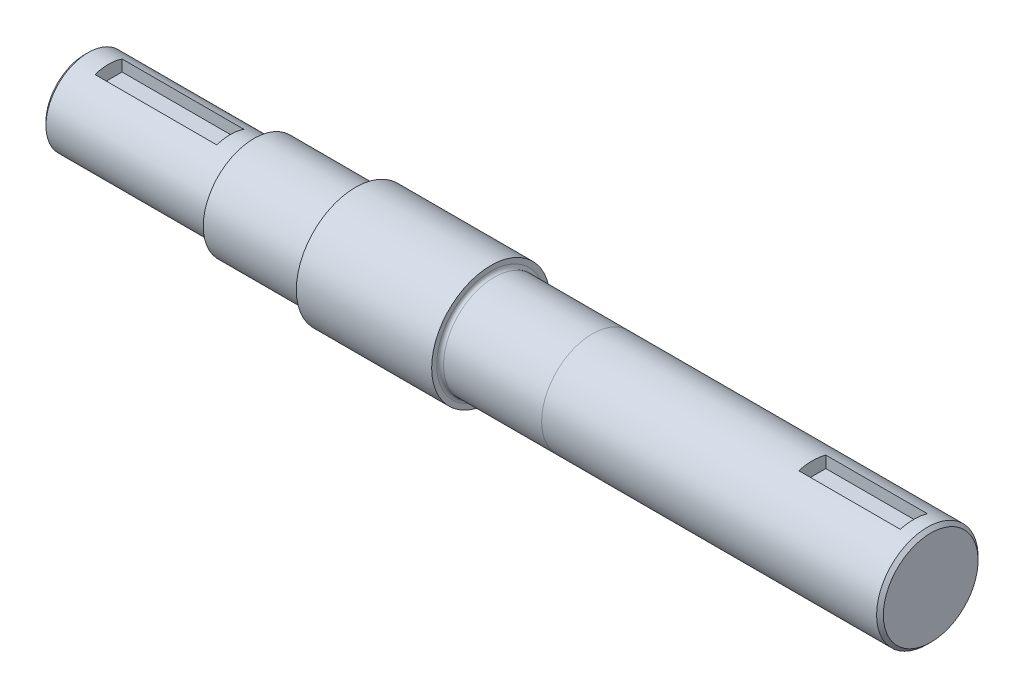
from build123d import *

# Parameters (mm, degrees)
SKETCH2_W          = 36
SKETCH2_H          = 8
CUT_EXTRUDE2_DEPTH = 252.956841542
SKETCH3_W          = 30
SKETCH3_H          = 8
CUT_EXTRUDE3_DEPTH = 253.227080227
FILLET1_R          = 1
CHAMFER1_SIZE      = 1


with BuildPart() as part:
    # Sketch1 → Revolve1 (revolve)
    with BuildSketch(Plane.XY, mode=Mode.PRIVATE) as revolve1_sk:
        Polygon((0, 0), (0, 12.5), (50, 12.5), (50, 15), (80, 15), (80, 17.5), (120, 17.5), (120, 15), (250, 15), (250, 0), align=None)
    revolve(revolve1_sk.sketch.rotate(Axis((0, 0, 0), (1, 0, 0)), 90), axis=Axis((0, 0, 0), (1, 0, 0)))

    # Sketch2 → Cut-Extrude2 (cut, through all)
    with BuildSketch(Plane(origin=(0, 8.5, 0), x_dir=(1, 0, 0), z_dir=(0, 1, 0))):
        with Locations((25, 0)):
            Rectangle(SKETCH2_W, SKETCH2_H)
    extrude(amount=CUT_EXTRUDE2_DEPTH, mode=Mode.SUBTRACT)

    # Sketch3 → Cut-Extrude3 (cut, through all)
    with BuildSketch(Plane(origin=(0, 11, 0), x_dir=(1, 0, 0), z_dir=(0, 1, 0))):
        with Locations((230, 0)):
            Rectangle(SKETCH3_W, SKETCH3_H)
    extrude(amount=CUT_EXTRUDE3_DEPTH, mode=Mode.SUBTRACT)

    # Fillet1
    fillet1_edges = [part.edges().sort_by_distance(p)[0] for p in [
        (80, 0, -15),
        (50, 0, -12.5),
        (120, 0, -15),
    ]]
    fillet(fillet1_edges, radius=FILLET1_R)

    # Chamfer1
    chamfer1_edges = [part.edges().sort_by_distance(p)[0] for p in [
        (0, 0, -12.5),
        (250, 0, -15),
    ]]
    chamfer(chamfer1_edges, length=CHAMFER1_SIZE)


solid = part.part
